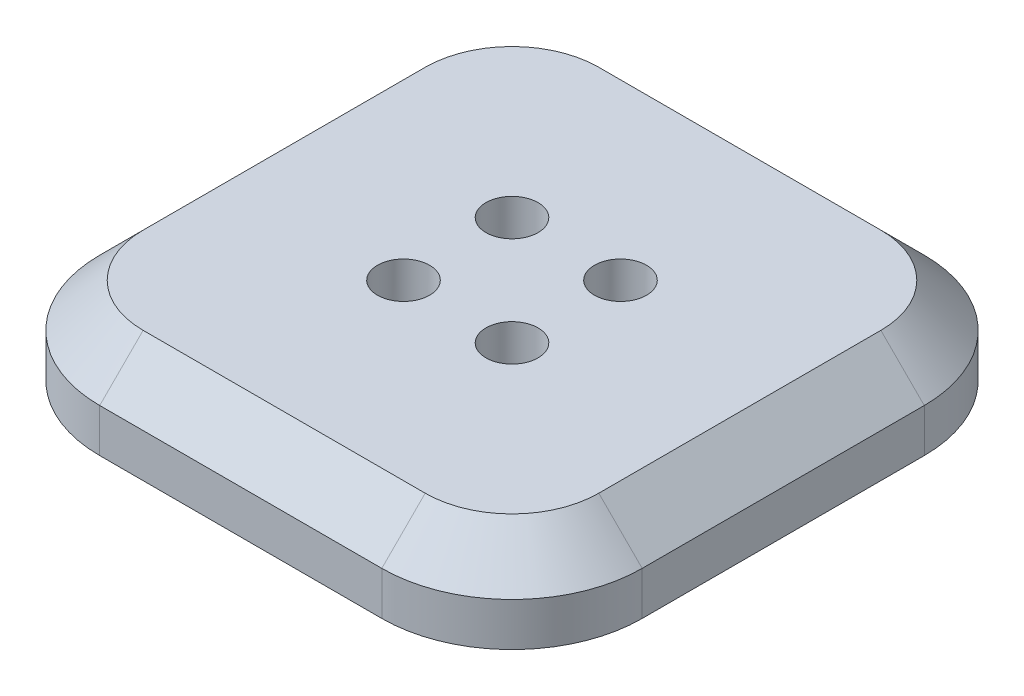
from build123d import *

# Parameters (mm, degrees)
BOSS_EXTRUDE1_DEPTH = 10
CHAMFER1_SIZE       = 10
SKETCH2_R           = 6
CUT_EXTRUDE1_DEPTH  = 10
SKETCH3_R           = 6
CUT_EXTRUDE2_DEPTH  = 10


with BuildPart() as part:
    # Sketch1 → Boss-Extrude1 (new, symmetric)
    with BuildSketch(Plane(origin=(0, 0, 0), x_dir=(1, 0, 0), z_dir=(0, 1, 0))):
        with BuildLine():
            Line((-32.5, 62.5), (32.5, 62.5))
            ThreePointArc((32.5, 62.5), (53.713203436, 53.713203436), (62.5, 32.5))
            Line((62.5, 32.5), (62.5, -32.5))
            ThreePointArc((62.5, -32.5), (53.713203436, -53.713203436), (32.5, -62.5))
            Line((32.5, -62.5), (-32.5, -62.5))
            ThreePointArc((-32.5, -62.5), (-53.713203436, -53.713203436), (-62.5, -32.5))
            Line((-62.5, -32.5), (-62.5, 32.5))
            ThreePointArc((-62.5, 32.5), (-53.713203436, 53.713203436), (-32.5, 62.5))
        make_face()
    extrude(amount=BOSS_EXTRUDE1_DEPTH, both=True)

    # Chamfer1
    chamfer1_edges = [part.edges().sort_by_distance(p)[0] for p in [
        (53.713203436, 10, 53.713203436),
        (62.5, 10, 0),
        (53.713203436, 10, -53.713203436),
        (0, 10, -62.5),
        (-53.713203436, 10, -53.713203436),
        (-62.5, 10, 0),
        (-53.713203436, 10, 53.713203436),
        (0, 10, 62.5),
    ]]
    chamfer(chamfer1_edges, length=CHAMFER1_SIZE)

    # Sketch2 → Cut-Extrude1 (cut)
    with BuildSketch(Plane(origin=(0, 10, 0), x_dir=(1, 0, 0), z_dir=(0, 1, 0))):
        with Locations(Location((12.5, 12.5, 0), (0, 0, 270))):
            Circle(SKETCH2_R)
        with Locations(Location((-12.5, 12.5, 0), (0, 0, 90))):
            Circle(SKETCH2_R)
        with Locations(Location((12.5, -12.5, 0), (0, 0, 90))):
            Circle(SKETCH2_R)
        with Locations(Location((-12.5, -12.5, 0), (0, 0, 270))):
            Circle(SKETCH2_R)
    extrude(amount=-CUT_EXTRUDE1_DEPTH, mode=Mode.SUBTRACT)

    # Sketch3 → Cut-Extrude2 (cut)
    with BuildSketch(Plane.XZ.offset(10)):
        with Locations(Location((37.5, 37.5, 0), (0, 0, 270))):
            Circle(SKETCH3_R)
        with Locations(Location((-37.5, 37.5, 0), (0, 0, 270))):
            Circle(SKETCH3_R)
        with Locations(Location((37.5, -37.5, 0), (0, 0, 270))):
            Circle(SKETCH3_R)
        with Locations(Location((-37.5, -37.5, 0), (0, 0, 270))):
            Circle(SKETCH3_R)
    extrude(amount=-CUT_EXTRUDE2_DEPTH, mode=Mode.SUBTRACT)


solid = part.part
